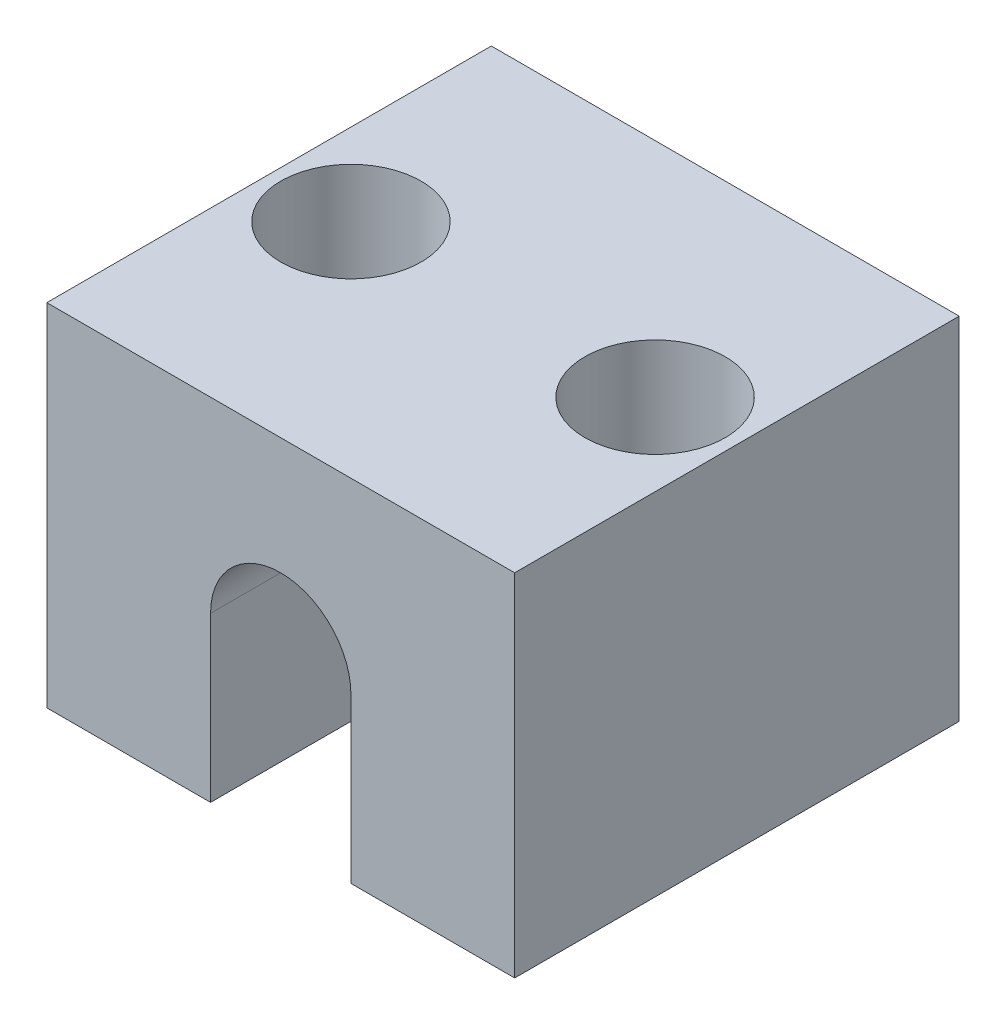
from build123d import *

# Parameters (mm, degrees)
BOSS_EXTRUDE1_DEPTH = 19
SKETCH2_R           = 1.8
CUT_EXTRUDE1_DEPTH  = 27.191601707
SKETCH2_3_R         = 3
SKETCH2_3_R_2       = 1.8
CUT_EXTRUDE2_DEPTH  = 12


with BuildPart() as part:
    # Sketch1 → Boss-Extrude1 (new body)
    with BuildSketch(Plane.XY):
        with BuildLine():
            Line((-10, 0), (-10, 15))
            Line((-10, 15), (10, 15))
            Line((10, 15), (10, 0))
            Line((10, 0), (3, 0))
            Line((3, 0), (3, 7))
            ThreePointArc((3, 7), (0, 10), (-3, 7))
            Line((-3, 7), (-3, 0))
            Line((-3, 0), (-10, 0))
        make_face()
    extrude(amount=BOSS_EXTRUDE1_DEPTH)

    # Sketch2 → Cut-Extrude1 (cut, through all)
    with BuildSketch(Plane(origin=(0, 15, 0), x_dir=(1, 0, 0), z_dir=(0, 1, 0))):
        with Locations(Location((-6.5, -9.5, 0), (0, 0, 270))):
            Circle(SKETCH2_R)
        with Locations(Location((6.5, -9.5, 0), (0, 0, 270))):
            Circle(SKETCH2_R)
    extrude(amount=-CUT_EXTRUDE1_DEPTH, mode=Mode.SUBTRACT)

    # Sketch2<3> → Cut-Extrude2 (cut)
    # profile 1 of 2: a face of its own
    with BuildSketch(Plane(origin=(0, 15, 0), x_dir=(1, 0, 0), z_dir=(0, 1, 0))):
        with Locations(Location((-6.5, -9.5, 0), (0, 0, 270))):
            Circle(SKETCH2_3_R)
        with Locations(Location((-6.5, -9.5, 0), (0, 0, 270))):
            Circle(SKETCH2_3_R_2, mode=Mode.SUBTRACT)
    # profile 2 of 2: a face of its own
    with BuildSketch(Plane(origin=(0, 15, 0), x_dir=(1, 0, 0), z_dir=(0, 1, 0))):
        with Locations(Location((6.5, -9.5, 0), (0, 0, 270))):
            Circle(SKETCH2_3_R)
        with Locations(Location((6.5, -9.5, 0), (0, 0, 270))):
            Circle(SKETCH2_3_R_2, mode=Mode.SUBTRACT)
    extrude(amount=-CUT_EXTRUDE2_DEPTH, mode=Mode.SUBTRACT)


solid = part.part
